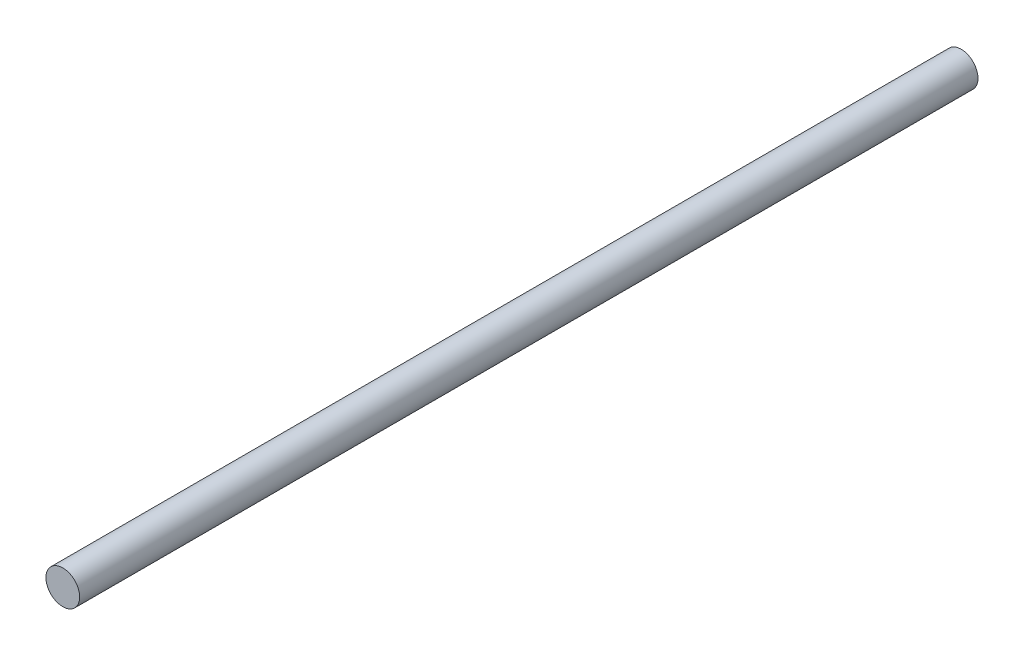
from build123d import *

# Parameters (mm, degrees)
SCHIZZO1_R                   = 7.5
ESTRUSIONE_ESTRUSIONE1_DEPTH = 200


with BuildPart() as part:
    # Schizzo1 → Estrusione-Estrusione1 (new, symmetric)
    with BuildSketch(Plane.XY):
        Circle(SCHIZZO1_R)
    extrude(amount=ESTRUSIONE_ESTRUSIONE1_DEPTH, both=True)


solid = part.part
